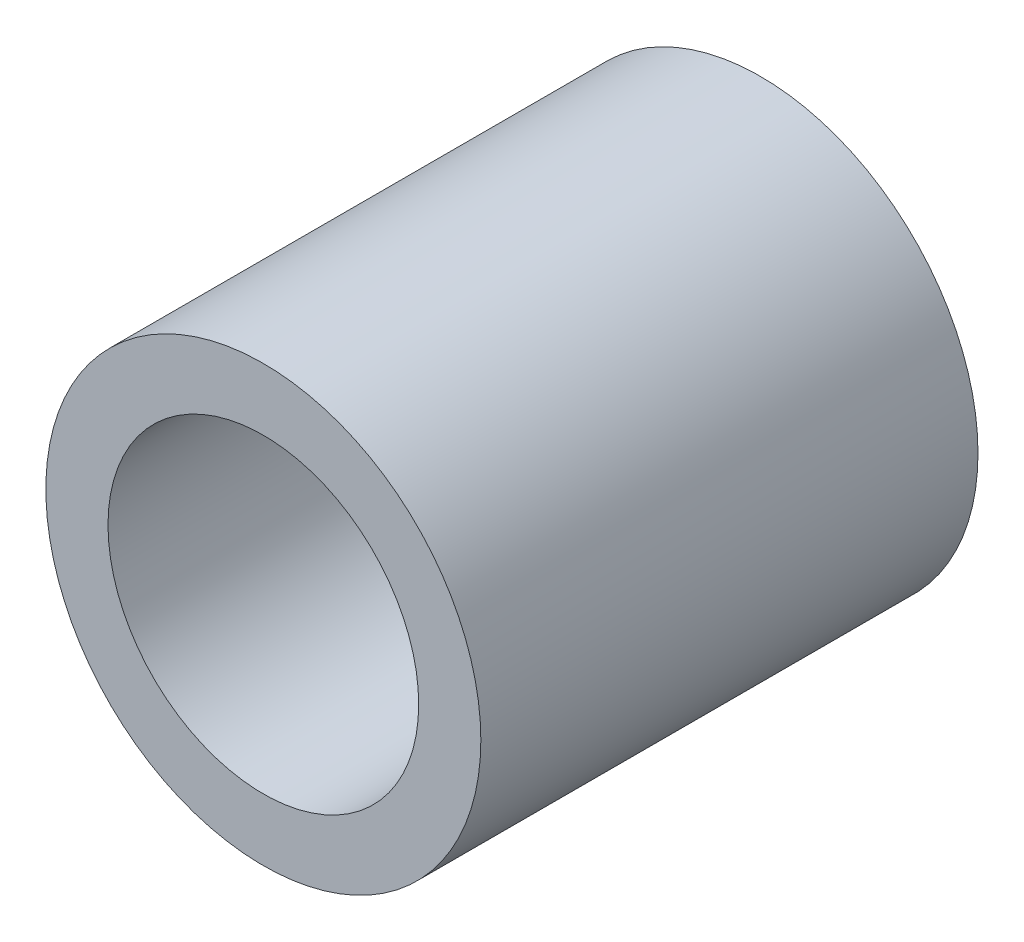
from build123d import *

# Parameters (mm, degrees)
SKETCH1_R           = 11.1125
SKETCH1_R_2         = 7.9375
BOSS_EXTRUDE1_DEPTH = 25.4


with BuildPart() as part:
    # Sketch1 → Boss-Extrude1 (new body)
    with BuildSketch(Plane.XY):
        Circle(SKETCH1_R)
        Circle(SKETCH1_R_2, mode=Mode.SUBTRACT)
    extrude(amount=BOSS_EXTRUDE1_DEPTH)


solid = part.part
